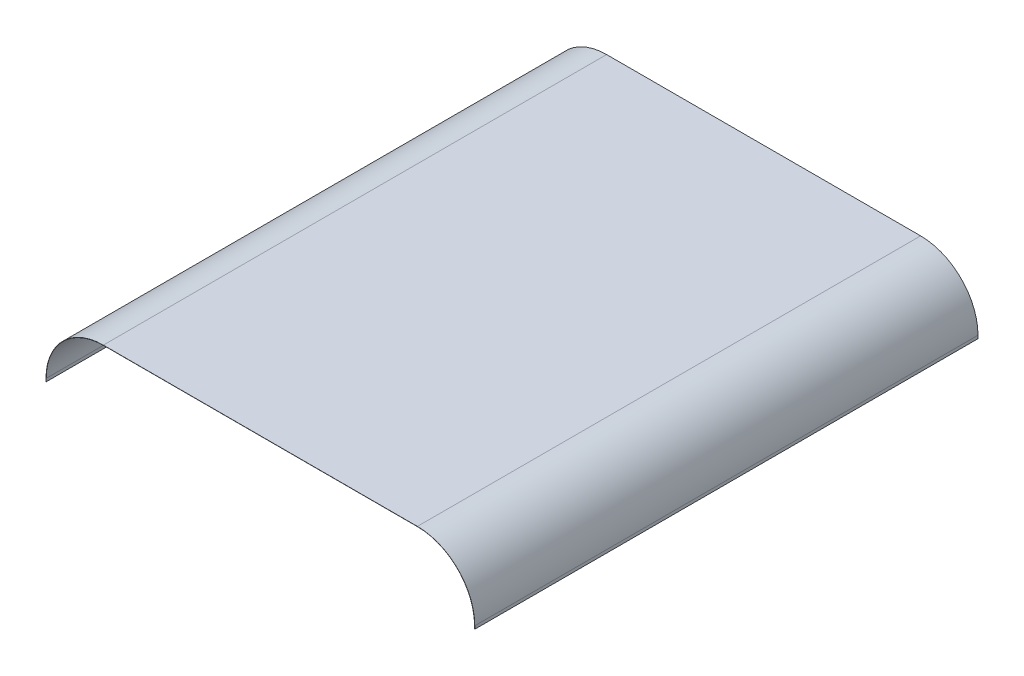
from build123d import *

# Parameters (mm, degrees)
SURFACE_EXTRUDE2_1_DEPTH = 2500
THICKEN1_T2              = 1


with BuildPart() as body_1:
    # Surface-Extrude2: a surface, the sketch's curves swept straight by 2500 mm
    with BuildLine(Plane.XY, mode=Mode.PRIVATE) as surface_extrude2_1_path:
        Line((0, -15), (0, 0))
        ThreePointArc((0, 0), (83.474567362, 201.525432638), (285, 285))
        Line((285, 285), (1845, 285))
        ThreePointArc((1845, 285), (2046.525432638, 201.525432638), (2130, 0))
        Line((2130, 0), (2130, -15))
    surface_extrude2_1 = Shell.extrude(surface_extrude2_1_path.wire(), (0 * SURFACE_EXTRUDE2_1_DEPTH, 0 * SURFACE_EXTRUDE2_1_DEPTH, 1 * SURFACE_EXTRUDE2_1_DEPTH))
    add(Solid.thicken(surface_extrude2_1, -THICKEN1_T2))


solid = body_1.part
